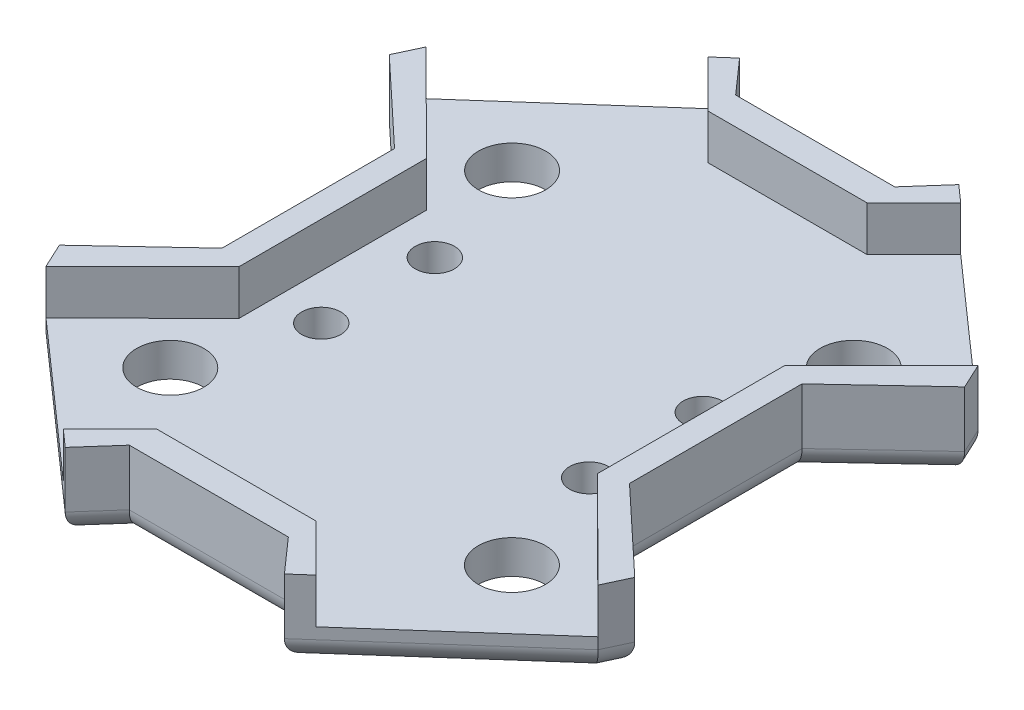
from build123d import *

# Parameters (mm, degrees)
SKETCH1_W           = 55
SKETCH1_H           = 64.43
BOSS_EXTRUDE1_DEPTH = 3
CUT_EXTRUDE1_DEPTH  = 4
SKETCH3_OUTSIDE_W   = 73.954
SKETCH3_OUTSIDE_H   = 83.384
CUT_EXTRUDE4_DEPTH  = 4
BOSS_EXTRUDE2_DEPTH = 3
BOSS_EXTRUDE3_DEPTH = 3
BOSS_EXTRUDE4_DEPTH = 4
BOSS_EXTRUDE5_DEPTH = 4
FILLET1_R           = 2
SKETCH9_R           = 1.75
CUT_EXTRUDE6_DEPTH  = 40.766745199
SKETCH10_R          = 3
CUT_EXTRUDE7_DEPTH  = 3
SKETCH11_R          = 1.75
CUT_EXTRUDE8_DEPTH  = 40.766745199


with BuildPart() as part:
    # Sketch1 → Boss-Extrude1 (new body)
    with BuildSketch(Plane(origin=(0, 0, 0), x_dir=(1, 0, 0), z_dir=(0, 1, 0))):
        Rectangle(SKETCH1_W, SKETCH1_H)
    extrude(amount=BOSS_EXTRUDE1_DEPTH)

    # Sketch2 → Cut-Extrude1 (cut)
    with BuildSketch(Plane(origin=(0, 3, 0), x_dir=(1, 0, 0), z_dir=(0, 1, 0))):
        Polygon((-27.5, -4.791277462), (-27.5, -14.373832386), (-17.5, -5), (-17.5, 5), (-27.5, 14.373832386), (-27.5, 4.791277462), align=None)
        Polygon((27.5, 4.791277462), (27.5, 14.373832386), (17.5, 5), (17.5, -5), (27.5, -14.373832386), (27.5, -4.791277462), align=None)
    extrude(amount=-CUT_EXTRUDE1_DEPTH, mode=Mode.SUBTRACT)

    # Sketch3 outside → Cut-Extrude4 (cut)
    with BuildSketch(Plane(origin=(0, 3, 0), x_dir=(1, 0, 0), z_dir=(0, 1, 0))):
        Rectangle(SKETCH3_OUTSIDE_W, SKETCH3_OUTSIDE_H)
        Polygon((-16, -5.649903378), (-16, 0), (-16, 5.649903378), (-25.681219861, 14.724916605), (-24.640371834, 16.957022404), (-9.782767538, 30.09765722), (-4.418267546, 24.032225889), (4.418267546, 24.032225889), (9.782767538, 30.09765722), (24.640371834, 16.957022404), (25.681219861, 14.724916605), (16, 5.649903378), (16, -5.649903378), (25.681219861, -14.724916605), (24.640371834, -16.957022404), (9.782767538, -30.09765722), (4.418267546, -24.032225889), (-4.418267546, -24.032225889), (-9.782767538, -30.09765722), (-24.640371834, -16.957022404), (-25.681219861, -14.724916605), align=None, mode=Mode.SUBTRACT)
    extrude(amount=-CUT_EXTRUDE4_DEPTH, mode=Mode.SUBTRACT)

    # Sketch4 → Boss-Extrude2 (add)
    with BuildSketch(Plane(origin=(0, 3, 0), x_dir=(1, 0, 0), z_dir=(0, 1, 0))):
        Polygon((-7.100517542, 27.064941555), (7.100517542, 27.064941555), (4.418267546, 24.032225889), (-4.418267546, 24.032225889), align=None)
        Polygon((-7.100517542, -27.064941555), (7.100517542, -27.064941555), (4.418267546, -24.032225889), (-4.418267546, -24.032225889), align=None)
    extrude(amount=-BOSS_EXTRUDE2_DEPTH)

    # Sketch5 → Boss-Extrude3 (add)
    with BuildSketch(Plane(origin=(0, 3, 0), x_dir=(1, 0, 0), z_dir=(0, 1, 0))):
        Polygon((-16, 5.649903378), (-18.188739123, 7.701590745), (-18.188739123, -7.701590745), (-16, -5.649903378), align=None)
        Polygon((16, 5.649903378), (18.188739123, 7.701590745), (18.188739123, -7.701590745), (16, -5.649903378), align=None)
    extrude(amount=-BOSS_EXTRUDE3_DEPTH)

    # Sketch6 → Boss-Extrude4 (add)
    with BuildSketch(Plane(origin=(0, 3, 0), x_dir=(1, 0, 0), z_dir=(0, 1, 0))):
        Polygon((-24.640371834, -16.957022404), (-25.681219861, -14.724916605), (-18.188739123, -7.701590745), (-18.188739123, 7.701590745), (-25.681219861, 14.724916605), (-24.640371834, 16.957022404), (-16, 8.373408054), (-16, -8.373408054), align=None)
        Polygon((16, -8.373408054), (24.640371834, -16.957022404), (25.681219861, -14.724916605), (18.188739123, -7.701590745), (18.188739123, 7.701590745), (25.681219861, 14.724916605), (24.640371834, 16.957022404), (16, 8.373408054), align=None)
    extrude(amount=BOSS_EXTRUDE4_DEPTH)

    # Sketch7 → Boss-Extrude5 (add)
    with BuildSketch(Plane(origin=(0, 3, 0), x_dir=(1, 0, 0), z_dir=(0, 1, 0))):
        Polygon((-1, 27.064941555), (-7.100517542, 27.064941555), (-9.782767538, 30.09765722), (-11.280892286, 28.772658262), (-7.100517542, 24.594941555), (-1, 24.594941555), (1, 24.594941555), (7.100517542, 24.594941555), (11.280892286, 28.772658262), (9.782767538, 30.09765722), (7.100517542, 27.064941555), (1, 27.064941555), align=None)
        Polygon((-1, -27.064941555), (-7.100517542, -27.064941555), (-9.782767538, -30.09765722), (-11.280892286, -28.772658262), (-7.100517542, -24.594941555), (-1, -24.594941555), (1, -24.594941555), (7.100517542, -24.594941555), (11.280892286, -28.772658262), (9.782767538, -30.09765722), (7.100517542, -27.064941555), (1, -27.064941555), align=None)
    extrude(amount=BOSS_EXTRUDE5_DEPTH)

    # Fillet1
    fillet1_edges = [part.edges().sort_by_distance(p)[0] for p in [
        (0, 0, -27.064941555),
        (0, 0, 27.064941555),
        (-21.934979492, 0, 11.213253675),
        (-21.934979492, 0, -11.213253675),
        (21.934979492, 0, -11.213253675),
        (21.934979492, 0, 11.213253675),
        (-18.188739123, 0, 0),
        (18.188739123, 0, 0),
        (-25.160795848, 0, 15.840969504),
        (-17.211569686, 0, 23.527339812),
        (-8.44164254, 0, 28.581299387),
        (8.44164254, 0, 28.581299387),
        (17.211569686, 0, 23.527339812),
        (25.160795848, 0, 15.840969504),
        (25.160795848, 0, -15.840969504),
        (17.211569686, 0, -23.527339812),
        (8.44164254, 0, -28.581299387),
        (-8.44164254, 0, -28.581299387),
        (-17.211569686, 0, -23.527339812),
        (-25.160795848, 0, -15.840969504),
    ]]
    fillet(fillet1_edges, radius=FILLET1_R)

    # Sketch9 → Cut-Extrude6 (cut, through all)
    with BuildSketch(Plane(origin=(0, 3, 0), x_dir=(1, 0, 0), z_dir=(0, 1, 0))):
        with Locations(Location((15.251219861, -15.244152763, 0), (0, 0, 270))):
            Circle(SKETCH9_R)
        with Locations(Location((15.251219861, 15.255847237, 0), (0, 0, 270))):
            Circle(SKETCH9_R)
        with Locations(Location((-15.248780139, 15.255847237, 0), (0, 0, 270))):
            Circle(SKETCH9_R)
        with Locations(Location((-15.248780139, -15.244152763, 0), (0, 0, 270))):
            Circle(SKETCH9_R)
    extrude(amount=-CUT_EXTRUDE6_DEPTH, mode=Mode.SUBTRACT)

    # Sketch10 → Cut-Extrude7 (cut)
    with BuildSketch(Plane.XZ):
        with Locations(Location((-15.248780139, -15.255847237, 0), (0, 0, 270))):
            Circle(SKETCH10_R)
        with Locations(Location((-15.248780139, 15.255847237, 0), (0, 0, 90))):
            Circle(SKETCH10_R)
        with Locations(Location((15.248780139, -15.255847237, 0), (0, 0, 90))):
            Circle(SKETCH10_R)
        with Locations(Location((15.248780139, 15.255847237, 0), (0, 0, 270))):
            Circle(SKETCH10_R)
    extrude(amount=-CUT_EXTRUDE7_DEPTH, mode=Mode.SUBTRACT)

    # Sketch11 → Cut-Extrude8 (cut, through all)
    with BuildSketch(Plane(origin=(0, 3, 0), x_dir=(1, 0, 0), z_dir=(0, 1, 0))):
        with Locations(Location((11.958739123, -5.07, 0), (0, 0, 270))):
            Circle(SKETCH11_R)
        with Locations(Location((11.958739123, 5.07, 0), (0, 0, 270))):
            Circle(SKETCH11_R)
        with Locations(Location((-11.958739123, -5.07, 0), (0, 0, 270))):
            Circle(SKETCH11_R)
        with Locations(Location((-11.958739123, 5.07, 0), (0, 0, 270))):
            Circle(SKETCH11_R)
    extrude(amount=-CUT_EXTRUDE8_DEPTH, mode=Mode.SUBTRACT)


solid = part.part
